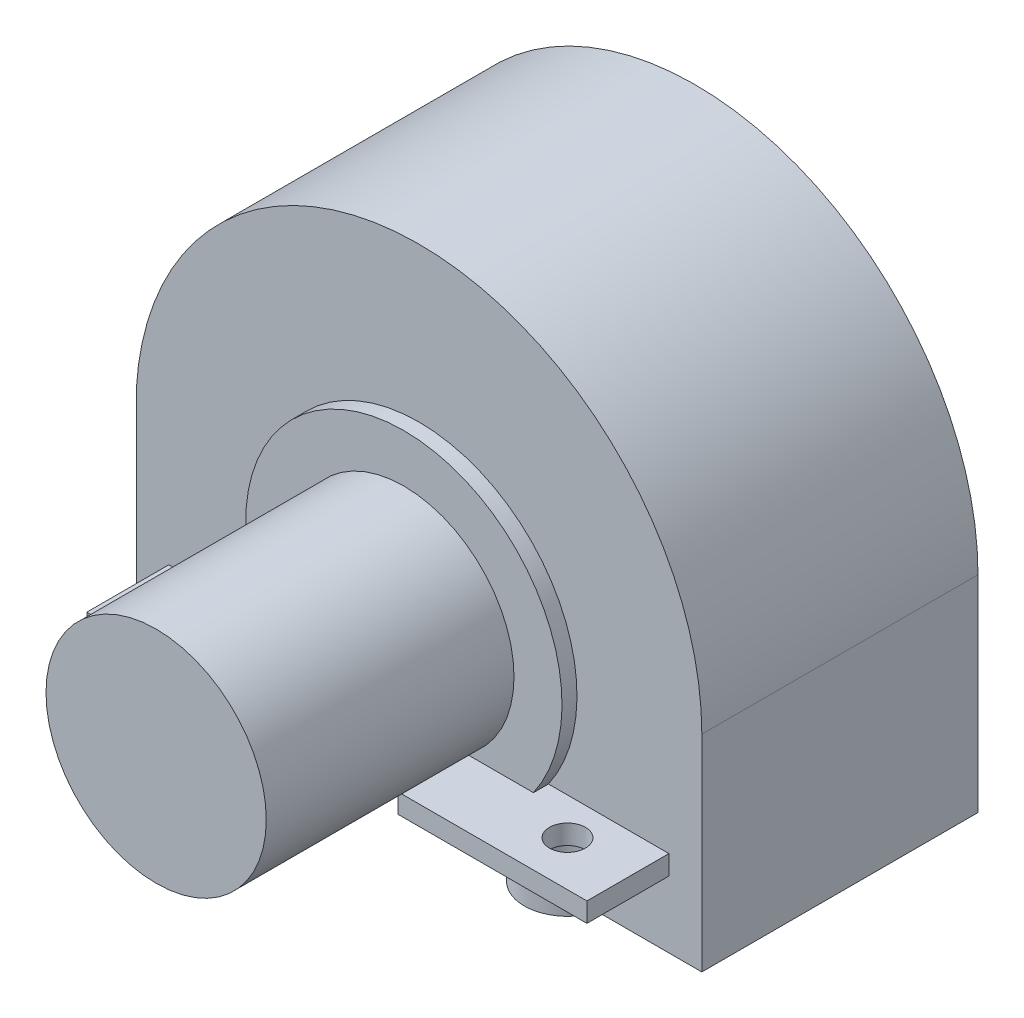
from build123d import *

# Parameters (mm, degrees)
BOSS_EXTRUDE1_DEPTH  = 36.0172
SKETCH7_R            = 31.2928
BOSS_EXTRUDE4_DEPTH  = 36.0172
CUT_EXTRUDE2_START   = -6.35
CUT_EXTRUDE2_DEPTH   = 6.35
CUT_EXTRUDE3_DEPTH   = 10.795
SKETCH10_R           = 2.8067
BOSS_EXTRUDE5_DEPTH  = 5.4864
SKETCH11_R           = 20.6248
BOSS_EXTRUDE6_DEPTH  = 1.9558
SKETCH12_R           = 14.3637
BOSS_EXTRUDE7_DEPTH  = 32.3088
BOSS_EXTRUDE9_DEPTH  = 10.6934
SKETCH14_R           = 2.3495
CUT_EXTRUDE4_DEPTH   = 2.54
SKETCH15_W           = 27.051
SKETCH15_H           = 2.54
BOSS_EXTRUDE10_DEPTH = 11.3538
SKETCH16_R           = 2.3495
CUT_EXTRUDE5_DEPTH   = 2.54
SKETCH17_R           = 3.7846
BOSS_EXTRUDE11_DEPTH = 2.3622
SKETCH18_R           = 3.7846
BOSS_EXTRUDE13_DEPTH = 2.3622


with BuildPart() as part:
    # Sketch1 → Boss-Extrude1 (new body)
    with BuildSketch(Plane.XY):
        with BuildLine():
            ThreePointArc((36.843812273, 2.145016468), (0, 36.9062), (-36.843812273, 2.145016468))
            Line((-36.843812273, 2.145016468), (36.843812273, 2.145016468))
        make_face()
        with BuildLine():
            Line((36.843812273, 2.145016468), (-36.843812273, 2.145016468))
            Line((-36.843812273, 2.145016468), (-36.843812273, -2.145016468))
            ThreePointArc((-36.843812273, -2.145016468), (-33.44326867, -15.608183082), (-25.30834218, -26.861783532))
            Line((-25.30834218, -26.861783532), (25.30834218, -26.861783532))
            ThreePointArc((25.30834218, -26.861783532), (33.882903776, -14.629300398), (36.9062, 0))
            ThreePointArc((36.9062, 0), (36.890599771, 1.072961774), (36.843812273, 2.145016468))
        make_face()
        with BuildLine():
            Line((36.9062, -26.861783532), (36.9062, 0))
            ThreePointArc((36.9062, 0), (33.882903776, -14.629300398), (25.30834218, -26.861783532))
            Line((25.30834218, -26.861783532), (36.9062, -26.861783532))
        make_face()
        with BuildLine():
            ThreePointArc((-25.30834218, -26.861783532), (-33.44326867, -15.608183082), (-36.843812273, -2.145016468))
            Line((-36.843812273, -2.145016468), (-36.843812273, -26.861783532))
            Line((-36.843812273, -26.861783532), (-25.30834218, -26.861783532))
        make_face()
    extrude(amount=BOSS_EXTRUDE1_DEPTH)

    # Sketch7 → Boss-Extrude4 (add)
    with BuildSketch(Plane.XY.offset(36.0172)):
        with Locations((0, -3.81)):
            Circle(SKETCH7_R)
    extrude(amount=-BOSS_EXTRUDE4_DEPTH)

    # Sketch6 → Cut-Extrude2 (cut)
    with BuildSketch(Plane(origin=(0, 0, 0), x_dir=(-1, 0, 0), z_dir=(0, 0, -1)).offset(CUT_EXTRUDE2_START)):
        with BuildLine():
            Line((21.162575643, -26.861783532), (-21.162575643, -26.861783532))
            ThreePointArc((-21.162575643, -26.861783532), (0, -35.1028), (21.162575643, -26.861783532))
        make_face()
    extrude(amount=CUT_EXTRUDE2_DEPTH, mode=Mode.SUBTRACT)

    # Sketch9 → Cut-Extrude3 (cut)
    with BuildSketch(Plane.XY.offset(36.0172)):
        with BuildLine():
            Line((-21.162575643, -26.861783532), (21.162575643, -26.861783532))
            ThreePointArc((21.162575643, -26.861783532), (0, -35.1028), (-21.162575643, -26.861783532))
        make_face()
    extrude(amount=-CUT_EXTRUDE3_DEPTH, mode=Mode.SUBTRACT)

    # Sketch10 → Boss-Extrude5 (add)
    with BuildSketch(Plane(origin=(0, 0, 0), x_dir=(-1, 0, 0), z_dir=(0, 0, -1))):
        with Locations(Location((0, -3.81, 0), (0, 0, 180))):
            Circle(SKETCH10_R)
    extrude(amount=BOSS_EXTRUDE5_DEPTH)

    # Sketch11 → Boss-Extrude6 (add)
    with BuildSketch(Plane.XY.offset(36.0172)):
        with Locations((0, -3.81)):
            Circle(SKETCH11_R)
    extrude(amount=BOSS_EXTRUDE6_DEPTH)

    # Sketch12 → Boss-Extrude7 (add)
    with BuildSketch(Plane.XY.offset(37.973)):
        with Locations((0, -3.81)):
            Circle(SKETCH12_R)
    extrude(amount=BOSS_EXTRUDE7_DEPTH)

    # Sketch13 → Boss-Extrude9 (add)
    with BuildSketch(Plane.XY.offset(36.0172)):
        with BuildLine():
            Line((-32.6136, -18.1737), (-14.800895154, -18.1737))
            ThreePointArc((-14.800895154, -18.1737), (-15.900839256, -16.945664657), (-16.899186174, -15.6337))
            Line((-16.899186174, -15.6337), (-32.6136, -15.6337))
            Line((-32.6136, -15.6337), (-32.6136, -18.1737))
        make_face()
        with BuildLine():
            ThreePointArc((-16.899186174, -15.6337), (-15.900839256, -16.945664657), (-14.800895154, -18.1737))
            Line((-14.800895154, -18.1737), (-7.9756, -18.1737))
            Line((-7.9756, -18.1737), (-7.9756, -15.755948365))
            ThreePointArc((-7.9756, -15.755948365), (-8.065898573, -15.695165455), (-8.155733934, -15.6337))
            Line((-8.155733934, -15.6337), (-16.899186174, -15.6337))
        make_face()
        with BuildLine():
            Line((7.9756, -18.1737), (14.800895154, -18.1737))
            ThreePointArc((14.800895154, -18.1737), (15.900839256, -16.945664657), (16.899186174, -15.6337))
            Line((16.899186174, -15.6337), (8.155733934, -15.6337))
            ThreePointArc((8.155733934, -15.6337), (8.065898573, -15.695165455), (7.9756, -15.755948365))
            Line((7.9756, -15.755948365), (7.9756, -18.1737))
        make_face()
        with BuildLine():
            Line((14.800895154, -18.1737), (32.6136, -18.1737))
            Line((32.6136, -18.1737), (32.6136, -15.6337))
            Line((32.6136, -15.6337), (16.899186174, -15.6337))
            ThreePointArc((16.899186174, -15.6337), (15.900839256, -16.945664657), (14.800895154, -18.1737))
        make_face()
    extrude(amount=BOSS_EXTRUDE9_DEPTH)

    # Sketch14 → Cut-Extrude4 (cut)
    with BuildSketch(Plane(origin=(0, -15.6337, 0), x_dir=(1, 0, 0), z_dir=(0, 1, 0))):
        with Locations(Location((-24.2062, -40.8432, 0), (0, 0, 270))):
            Circle(SKETCH14_R)
        with Locations(Location((24.2062, -40.8432, 0), (0, 0, 270))):
            Circle(SKETCH14_R)
    extrude(amount=-CUT_EXTRUDE4_DEPTH, mode=Mode.SUBTRACT)

    # Sketch15 → Boss-Extrude10 (add)
    with BuildSketch(Plane(origin=(0, 0, 0), x_dir=(-1, 0, 0), z_dir=(0, 0, -1))):
        with Locations((-6.1595, -17.018)):
            Rectangle(SKETCH15_W, SKETCH15_H)
    extrude(amount=BOSS_EXTRUDE10_DEPTH)

    # Sketch16 → Cut-Extrude5 (cut)
    with BuildSketch(Plane(origin=(0, -15.748, 0), x_dir=(1, 0, 0), z_dir=(0, 1, 0))):
        with Locations(Location((5.698514736, 4.699, 0), (0, 0, 180))):
            Circle(SKETCH16_R)
    extrude(amount=-CUT_EXTRUDE5_DEPTH, mode=Mode.SUBTRACT)

    # Sketch17 → Boss-Extrude11 (add)
    with BuildSketch(Plane.XZ.offset(18.288)):
        with BuildLine():
            Line((0.072414736, -4.699), (0, 0))
            Line((0, 0), (11.324614736, 0))
            Line((11.324614736, 0), (11.324614736, -4.699))
            ThreePointArc((11.324614736, -4.699), (5.698514736, -10.3251), (0.072414736, -4.699))
        make_face()
        with Locations((5.698514736, -4.699)):
            Circle(SKETCH17_R, mode=Mode.SUBTRACT)
    extrude(amount=BOSS_EXTRUDE11_DEPTH)

    # Sketch18 → Boss-Extrude13 (add)
    # profile 1 of 2: a face of its own
    with BuildSketch(Plane.XZ.offset(18.1737)):
        with BuildLine():
            Line((-18.5801, 40.8432), (-18.5801, 36.0172))
            Line((-18.5801, 36.0172), (-29.8323, 36.0172))
            Line((-29.8323, 36.0172), (-29.8323, 40.8432))
            ThreePointArc((-29.8323, 40.8432), (-24.2062, 46.4693), (-18.5801, 40.8432))
        make_face()
        with Locations((-24.2062, 40.8432)):
            Circle(SKETCH18_R, mode=Mode.SUBTRACT)
    # profile 2 of 2: a face of its own
    with BuildSketch(Plane.XZ.offset(18.1737)):
        with BuildLine():
            Line((29.8323, 36.0172), (29.8323, 40.8432))
            ThreePointArc((29.8323, 40.8432), (24.2062, 46.4693), (18.5801, 40.8432))
            Line((18.5801, 40.8432), (18.5801, 36.0172))
            Line((18.5801, 36.0172), (29.8323, 36.0172))
        make_face()
        with Locations((24.2062, 40.8432)):
            Circle(SKETCH18_R, mode=Mode.SUBTRACT)
    extrude(amount=BOSS_EXTRUDE13_DEPTH)


solid = part.part
